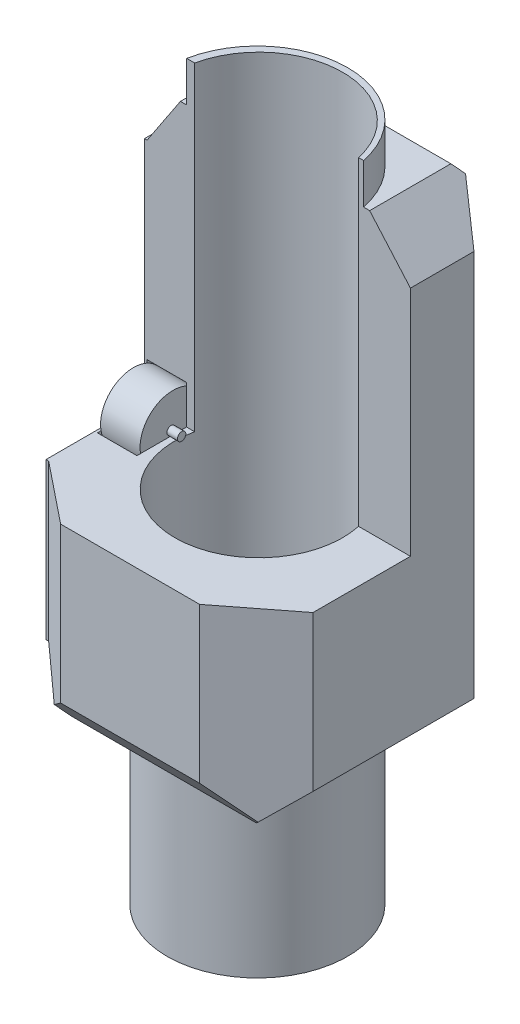
from build123d import *

# Parameters (mm, degrees)
SKETCH1_W            = 100
SKETCH1_H            = 100
BOSS_EXTRUDE1_DEPTH  = 180
SKETCH2_R            = 34.257790197
BOSS_EXTRUDE2_DEPTH  = 350
SKETCH3_W            = 152.006357392
SKETCH3_H            = 282.452416457
CUT_EXTRUDE2_DEPTH   = 400
CUT_EXTRUDE3_DEPTH   = 400
CUT_EXTRUDE4_DEPTH   = 400
CUT_EXTRUDE5_DEPTH   = 400
SKETCH7_W            = 160.159381639
SKETCH7_H            = 147.362276113
CUT_EXTRUDE6_DEPTH   = 400
SKETCH8_W            = 147.310744502
SKETCH8_H            = 162.038906966
CUT_EXTRUDE7_DEPTH   = 400
SKETCH9_R            = 31.847293423
CUT_EXTRUDE8_DEPTH   = 400
SKETCH10_W           = 140.220962397
SKETCH10_H           = 212.033531124
CUT_EXTRUDE9_DEPTH   = 400
SKETCH11_R           = 13.603137886
CUT_EXTRUDE11_DEPTH  = 15
SKETCH12_R           = 12.495422516
BOSS_EXTRUDE3_DEPTH  = 15
SKETCH13_R           = 1.594865099
BOSS_EXTRUDE4_DEPTH  = 4
SKETCH14_W           = 100.74862993
SKETCH14_H           = 110.555003588
CUT_EXTRUDE13_DEPTH  = 400
BOSS_EXTRUDE5_DEPTH  = 1
SKETCH16_W           = 24.504230724
SKETCH16_H           = 30.458347221
BOSS_EXTRUDE6_DEPTH  = 5
SKETCH17_W           = 18.669530869
SKETCH17_H           = 22.4027039
BOSS_EXTRUDE7_DEPTH  = 1
SKETCH18_W           = 4.907623399
SKETCH18_H           = 5.170746831
SKETCH18_W_2         = 3.981473695
SKETCH18_H_2         = 5.451349552
BOSS_EXTRUDE8_DEPTH  = 1
BOSS_EXTRUDE9_DEPTH  = 1
SKETCH21_W           = 16.281298494
SKETCH21_H           = 30.70477752
BOSS_EXTRUDE10_DEPTH = 5
SKETCH22_W           = 0.561666562
SKETCH22_H           = 0.603858724
SKETCH22_W_2         = 0.53443704
SKETCH22_W_3         = 0.536755884
SKETCH22_H_2         = 0.595744993
SKETCH22_W_4         = 0.555081497
SKETCH22_H_3         = 0.603543747
SKETCH22_H_4         = 0.606016701
SKETCH22_W_5         = 0.51195437
BOSS_EXTRUDE11_DEPTH = 1


with BuildPart() as part:
    # Sketch1 → Boss-Extrude1 (new body)
    with BuildSketch(Plane(origin=(0, 0, 0), x_dir=(1, 0, 0), z_dir=(0, 1, 0))):
        with Locations((-50, 50)):
            Rectangle(SKETCH1_W, SKETCH1_H)
    extrude(amount=BOSS_EXTRUDE1_DEPTH)

    # Sketch2 → Boss-Extrude2 (add, symmetric)
    with BuildSketch(Plane(origin=(0, 180, 0), x_dir=(1, 0, 0), z_dir=(0, 1, 0))):
        with Locations(Location((-51.377291833, 49.076536384, 0), (0, 0, 270))):
            Circle(SKETCH2_R)
    extrude(amount=BOSS_EXTRUDE2_DEPTH, both=True)

    # Sketch3 → Cut-Extrude2 (cut)
    with BuildSketch(Plane(origin=(0, 0, 0), x_dir=(0, 0, -1), z_dir=(1, 0, 0))):
        with Locations((57.419900112, 502.274302507)):
            Rectangle(SKETCH3_W, SKETCH3_H)
    extrude(amount=-CUT_EXTRUDE2_DEPTH, mode=Mode.SUBTRACT)

    # Sketch4 → Cut-Extrude3 (cut)
    with BuildSketch(Plane(origin=(0, 0, 0), x_dir=(0, 0, -1), z_dir=(1, 0, 0))):
        Polygon((12.981970869, 0), (-8.994244796, 25.828096003), (-18.564506014, -15.259465835), align=None)
        Polygon((85.072517936, -1.448103984), (109.237639161, 19.113145112), (115.920034239, -3.267382694), align=None)
        Polygon((12.981970869, 180), (-8.994244796, 148.537596011), (-15.418178585, 193.219274892), align=None)
        Polygon((85.072517936, 181.854312784), (103.841225373, 159.795920888), (106.132549481, 198.647393934), align=None)
    extrude(amount=-CUT_EXTRUDE3_DEPTH, mode=Mode.SUBTRACT)

    # Sketch5 → Cut-Extrude4 (cut)
    with BuildSketch(Plane.XY):
        Polygon((-85.623287335, 0), (-106.370377984, 21.426392531), (-122.288861874, 3.209259887), (-93.526345261, -19.884701759), align=None)
        Polygon((-15.694988751, 0), (0, 15.257385304), (12.122677088, 15.257385304), (10.563067769, -19.884701759), align=None)
        Polygon((-87.166490339, 180.248071029), (-106.370377984, 151.29108453), (-117.705469457, 200.501115102), align=None)
        Polygon((-15.694988751, 180.248071029), (7.833767065, 153.279557508), (0, 193.941208308), align=None)
    extrude(amount=-CUT_EXTRUDE4_DEPTH, mode=Mode.SUBTRACT)

    # Sketch6 → Cut-Extrude5 (cut)
    with BuildSketch(Plane(origin=(0, 180, 0), x_dir=(1, 0, 0), z_dir=(0, 1, 0))):
        Polygon((-112.386997555, 28.400400964), (-64.261264503, -10.212759359), (-84.406366528, -15.51192827), (-124.649689542, -15.51192827), align=None)
        Polygon((-97.065537028, 135.861756084), (-119.37552445, 77.792688888), (-118.043343626, 64.347606737), (-66.428694172, 110.575168787), align=None)
        Polygon((-24.69640689, -21.815840769), (11.092108798, -8.97361337), (17.428316417, 32.393768119), (-38.531576846, -11.139157378), align=None)
        Polygon((-17.445484601, 140.804394854), (35.417473102, 107.262520599), (9.305452855, 72.996438725), (-31.724385352, 103.625272537), align=None)
    extrude(amount=-CUT_EXTRUDE5_DEPTH, mode=Mode.SUBTRACT)

    # Sketch7 → Cut-Extrude6 (cut)
    with BuildSketch(Plane.XY):
        with Locations((-66.123258915, -136.36252694)):
            Rectangle(SKETCH7_W, SKETCH7_H)
    extrude(amount=-CUT_EXTRUDE6_DEPTH, mode=Mode.SUBTRACT)

    # Sketch8 → Cut-Extrude7 (cut)
    with BuildSketch(Plane.XY):
        with Locations((-53.541153336, 332.448287589)):
            Rectangle(SKETCH8_W, SKETCH8_H)
    extrude(amount=-CUT_EXTRUDE7_DEPTH, mode=Mode.SUBTRACT)

    # Sketch9 → Cut-Extrude8 (cut)
    with BuildSketch(Plane(origin=(0, 251.428834106, 0), x_dir=(1, 0, 0), z_dir=(0, 1, 0))):
        with Locations(Location((-50.808993157, 49.032036374, 0), (0, 0, 270))):
            Circle(SKETCH9_R)
    extrude(amount=-CUT_EXTRUDE8_DEPTH, mode=Mode.SUBTRACT)

    # Sketch10 → Cut-Extrude9 (cut)
    with BuildSketch(Plane.ZY.offset(100)):
        with Locations((14.299084536, 180.100625535)):
            Rectangle(SKETCH10_W, SKETCH10_H)
    extrude(amount=-CUT_EXTRUDE9_DEPTH, mode=Mode.SUBTRACT)

    # Sketch11 → Cut-Extrude11 (cut)
    with BuildSketch(Plane.ZY.offset(100)):
        with Locations((-50.413251954, 76.264646142)):
            Circle(SKETCH11_R)
    extrude(amount=-CUT_EXTRUDE11_DEPTH, mode=Mode.SUBTRACT)

    # Sketch12 → Boss-Extrude3 (add)
    with BuildSketch(Plane.ZY.offset(85)):
        with Locations(Location((-50.658800768, 76.222522328, 0), (0, 0, 114.353089558))):
            Circle(SKETCH12_R)
    extrude(amount=BOSS_EXTRUDE3_DEPTH)

    # Sketch13 → Boss-Extrude4 (add)
    with BuildSketch(Plane(origin=(-85, 0, 0), x_dir=(0, 0, -1), z_dir=(1, 0, 0))):
        with Locations(Location((49.945205578, 75.944780088, 0), (0, 0, 180))):
            Circle(SKETCH13_R)
    extrude(amount=BOSS_EXTRUDE4_DEPTH)

    # Sketch14 → Cut-Extrude13 (cut)
    with BuildSketch(Plane.ZY.offset(100)):
        with Locations((-65.350029467, 250.603414818)):
            Rectangle(SKETCH14_W, SKETCH14_H)
    extrude(amount=-CUT_EXTRUDE13_DEPTH, mode=Mode.SUBTRACT)

    # Sketch15 → Boss-Extrude5 (add)
    with BuildSketch(Plane.ZY.offset(100)):
        Polygon((-18.461827727, 14.847435435), (-80.507743362, 14.847435435), (-80.507743362, 160.896793159), (-55.811396663, 160.896793159), (-55.811396663, 74.083859973), (-18.461827727, 74.083859973), align=None)
    extrude(amount=BOSS_EXTRUDE5_DEPTH)

    # Sketch16 → Boss-Extrude6 (add)
    with BuildSketch(Plane.ZY.offset(101)):
        with Locations((-39.275145749, 45.136437142)):
            Rectangle(SKETCH16_W, SKETCH16_H)
    extrude(amount=BOSS_EXTRUDE6_DEPTH)

    # Sketch17 → Boss-Extrude7 (add)
    with BuildSketch(Plane.ZY.offset(101)):
        with Locations((-67.04663872, 130.409241603)):
            Rectangle(SKETCH17_W, SKETCH17_H)
    extrude(amount=BOSS_EXTRUDE7_DEPTH)

    # Sketch18 → Boss-Extrude8 (add)
    with BuildSketch(Plane.ZY.offset(102)):
        with Locations((-71.625108618, 130.213401885)):
            Rectangle(SKETCH18_W, SKETCH18_H)
        with Locations((-62.297675883, 129.867186512)):
            Rectangle(SKETCH18_W_2, SKETCH18_H_2)
    extrude(amount=BOSS_EXTRUDE8_DEPTH)

    # Sketch19 → Boss-Extrude9 (add)
    with BuildSketch(Plane.ZY.offset(102)):
        Polygon((-66.976455081, 134.868836652), (-73.7929295, 134.868836652), (-73.7929295, 134.108269479), (-74.571872104, 134.108269479), (-74.571872104, 140.512729543), (-73.7929295, 140.512729543), (-72.165965418, 140.512729543), (-72.233411796, 137.421948277), (-71.48458153, 137.421948277), (-71.410861795, 140.512729543), (-69.158339735, 140.504865112), (-69.158339735, 137.421948277), (-68.22174926, 137.421948277), (-68.22174926, 140.567922793), (-65.426885805, 140.567922793), (-65.515241968, 137.446210948), (-64.714122339, 137.446210948), (-64.714122339, 140.567922793), (-62.410871788, 140.567922793), (-62.410871788, 137.210126003), (-61.403493639, 137.210126003), (-61.403493639, 140.631129361), (-58.889974549, 140.631129361), (-58.889974549, 136.595539338), (-59.698319644, 136.595539338), (-59.698319644, 139.99489006), (-60.695848378, 139.984078324), (-60.695848378, 136.667717235), (-63.090112056, 136.667717235), (-63.090112056, 139.979723883), (-64.00479018, 139.979723883), (-64.00479018, 136.667717235), (-66.334605538, 136.667717235), (-66.334605538, 139.902697072), (-67.48995239, 139.902697072), (-67.48995239, 136.667717235), (-70.008746759, 136.667717235), (-70.008746759, 139.902697072), (-70.709698815, 139.902697072), (-70.783897489, 136.693128041), (-72.921241048, 136.693128041), (-72.921241048, 139.545601992), (-73.7929295, 139.545601992), (-73.7929295, 135.423339258), (-66.976455081, 135.49721976), align=None)
    extrude(amount=BOSS_EXTRUDE9_DEPTH)

    # Sketch21 → Boss-Extrude10 (add)
    with BuildSketch(Plane.ZY.offset(101)):
        with Locations((-60.112791098, 44.859291254)):
            Rectangle(SKETCH21_W, SKETCH21_H)
    extrude(amount=BOSS_EXTRUDE10_DEPTH)

    # Sketch22 → Boss-Extrude11 (add)
    with BuildSketch(Plane.ZY.offset(102)):
        with Locations((-60.80943011, 132.899150377)):
            Rectangle(SKETCH22_W, SKETCH22_H)
        with Locations((-61.69225831, 132.899150377)):
            Rectangle(SKETCH22_W_2, SKETCH22_H)
        with Locations((-62.62493976, 132.903207243)):
            Rectangle(SKETCH22_W_3, SKETCH22_H_2)
        with Locations((-63.54978292, 132.899150377)):
            Rectangle(SKETCH22_W_4, SKETCH22_H)
        with Locations((-60.80943011, 126.809637752)):
            Rectangle(SKETCH22_W, SKETCH22_H_3)
        with Locations((-61.69225831, 126.810874229)):
            Rectangle(SKETCH22_W_2, SKETCH22_H_4)
        with Locations((-62.612539003, 126.810874229)):
            Rectangle(SKETCH22_W_5, SKETCH22_H_4)
        with Locations((-63.54978292, 126.810874229)):
            Rectangle(SKETCH22_W_4, SKETCH22_H_4)
    extrude(amount=BOSS_EXTRUDE11_DEPTH)


solid = part.part
